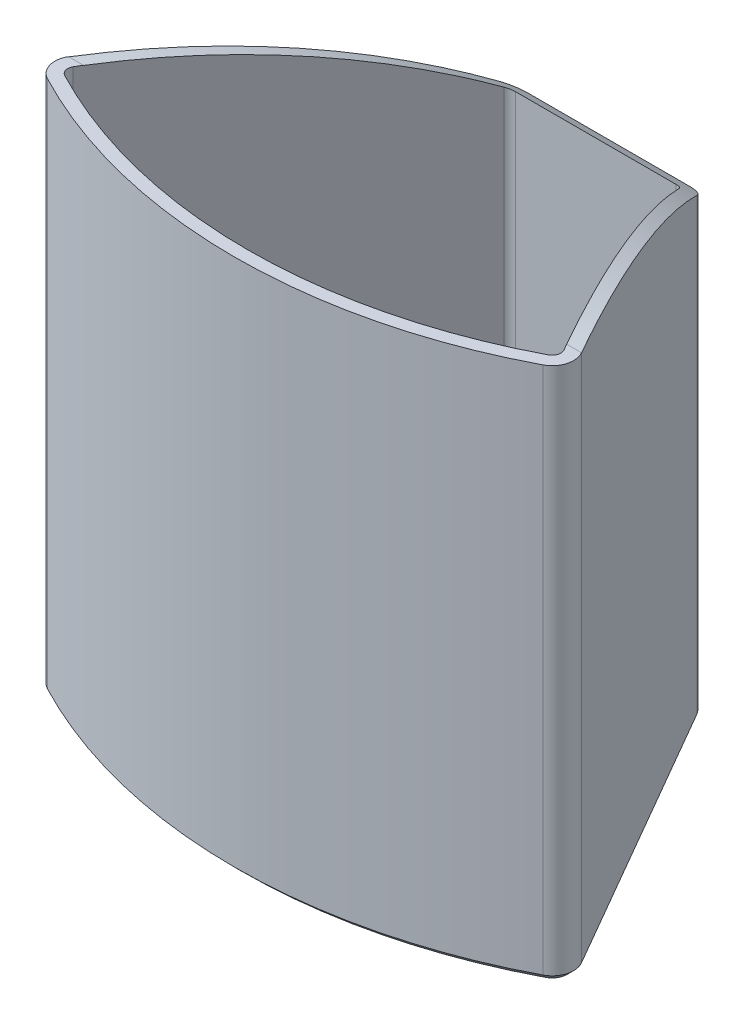
from build123d import *

# Parameters (mm, degrees)
SKETCH_1_R               = 50
EXTRUDE_1_DEPTH          = 50
CUT_EXTRUDE_2_DEPTH      = 87.602540378
CUT_EXTRUDE_3_DEPTH      = 76
FILLET_1_R               = 2
CHAMFER_1_SIZE           = 0.6
SHELL_1_T                = -1.2
EXTRUDE_2_DEPTH          = 2
EXTRUDE_2_DEPTH_BACK     = 2
SKETCH_4_R               = 1.5
SKETCH_5_R               = 1.5
EXTRUDE_3_DEPTH          = 3
CUT_EXTRUDE_4_DEPTH      = 75.752405905
CUT_EXTRUDE_4_DEPTH_BACK = 75.752405905
SKETCH_7_W               = 6.6
SKETCH_7_H               = 5.6
SKETCH_7_W_2             = 4
SKETCH_7_H_2             = 3
EXTRUDE_4_DEPTH          = 2.2
SKETCH_8_W               = 4
SKETCH_8_H               = 3
CUT_EXTRUDE_7_DEPTH      = 1.2
SKETCH_9_W               = 48.891646461
SKETCH_9_H               = 14.735047163
CUT_EXTRUDE_8_DEPTH      = 75.752405905
CHAMFER_2_SIZE           = 0.4
SKETCH_10_W              = 4.2
SKETCH_10_H              = 3.2
SKETCH_10_W_2            = 4
SKETCH_10_H_2            = 3
CUT_EXTRUDE_9_DEPTH      = 73.52228753
SKETCH_11_W              = 6.6
SKETCH_11_H              = 5.6
EXTRUDE_5_DEPTH          = 1.2


with BuildPart() as part:
    # 草图1 → 凸台-拉伸1 (new body)
    with BuildSketch(Plane(origin=(0, 0, 0), x_dir=(1, 0, 0), z_dir=(0, 1, 0))):
        with Locations(Location((0, 0, 0), (0, 0, 270))):
            Circle(SKETCH_1_R)
    extrude(amount=EXTRUDE_1_DEPTH)

    # 草图2 → 切除-拉伸2 (cut, through all)
    with BuildSketch(Plane(origin=(0, 50, 0), x_dir=(1, 0, 0), z_dir=(0, 1, 0))):
        with BuildLine():
            Line((-25, -43.301270189), (0, 0))
            Line((0, 0), (25, -43.301270189))
            ThreePointArc((25, -43.301270189), (0, 50), (-25, -43.301270189))
        make_face()
    extrude(amount=-CUT_EXTRUDE_2_DEPTH, mode=Mode.SUBTRACT)

    # 草图3 → 切除-拉伸3 (cut, through all)
    with BuildSketch(Plane(origin=(0, 50, 0), x_dir=(1, 0, 0), z_dir=(0, 1, 0))):
        with BuildLine():
            ThreePointArc((-7.5, -12.990381057), (-3.882285677, -14.488887394), (0, -15))
            ThreePointArc((0, -15), (3.882285677, -14.488887394), (7.5, -12.990381057))
            Line((7.5, -12.990381057), (0, 0))
            Line((0, 0), (-7.5, -12.990381057))
        make_face()
        with BuildLine():
            ThreePointArc((15, 0), (-7.5, 12.990381057), (-7.5, -12.990381057))
            Line((-7.5, -12.990381057), (0, 0))
            Line((0, 0), (7.5, -12.990381057))
            ThreePointArc((7.5, -12.990381057), (12.990381057, -7.5), (15, 0))
        make_face()
        with BuildLine():
            ThreePointArc((7.5, -12.990381057), (3.882285677, -14.488887394), (0, -15))
            Line((0, -15), (8.660254038, -15))
            Line((8.660254038, -15), (7.5, -12.990381057))
        make_face()
        with BuildLine():
            Line((-7.5, -12.990381057), (-8.660254038, -15))
            Line((-8.660254038, -15), (0, -15))
            ThreePointArc((0, -15), (-3.882285677, -14.488887394), (-7.5, -12.990381057))
        make_face()
    extrude(amount=-CUT_EXTRUDE_3_DEPTH, mode=Mode.SUBTRACT)

    # 圆角1
    fillet_1_edges = [part.edges().sort_by_distance(p)[0] for p in [
        (25, 25, 43.301270189),
        (-25, 25, 43.301270189),
        (-8.660254038, 25, 15),
        (8.660254038, 25, 15),
    ]]
    fillet(fillet_1_edges, radius=FILLET_1_R)

    # 倒角1
    chamfer_1_edges = [part.edges().sort_by_distance(p)[0] for p in [
        (0, 0, 15),
        (-16.608380962, 0, 28.766559657),
        (16.608380962, 0, 28.766559657),
        (0, 0, 50),
        (8.505553499, 0, 15.267949192),
        (24.167752526, 0, 43.090900659),
        (-24.167752526, 0, 43.090900659),
        (-8.505553499, 0, 15.267949192),
    ]]
    chamfer(chamfer_1_edges, length=CHAMFER_1_SIZE)

    # 抽壳1
    shell_1_openings = [part.faces().sort_by_distance(p)[0] for p in [
        (0, 50, 34.229276229),
    ]]
    offset(amount=SHELL_1_T, openings=shell_1_openings)

    # 草图4 → 凸台-拉伸2 (add, two sides: drawn at the far end of the back side and taken through both)
    with BuildSketch(Plane(origin=(0, 0, 0), x_dir=(0, 0, -1), z_dir=(1, 0, 0)).offset(-EXTRUDE_2_DEPTH_BACK)):
        with BuildLine():
            Line((-44.5, 0), (-44.5, -3))
            ThreePointArc((-44.5, -3), (-43, -1.5), (-41.5, -3))
            Line((-41.5, -3), (-41.5, 0))
            Line((-41.5, 0), (-44.5, 0))
        make_face()
        with Locations((-43, -3)):
            Circle(SKETCH_4_R)
    extrude(amount=EXTRUDE_2_DEPTH + EXTRUDE_2_DEPTH_BACK)

    # 草图5 → 凸台-拉伸3 (add)
    with BuildSketch(Plane(origin=(2, 0, 0), x_dir=(0, 0, -1), z_dir=(1, 0, 0))):
        with Locations((-43, -3)):
            Circle(SKETCH_5_R)
    extrude_3 = extrude(amount=EXTRUDE_3_DEPTH)

    # 镜向1: 凸台-拉伸3 across plane
    add(extrude_3.mirror(Plane(origin=(0, 0, 0), x_dir=(0, 0, 1), z_dir=(1, 0, 0))))

    # 草图6 → 切除-拉伸4 (cut, two sides: drawn at the far end of the back side and taken through both)
    with BuildSketch(Plane(origin=(0, 0, 0), x_dir=(0, 0, -1), z_dir=(1, 0, 0)).offset(-CUT_EXTRUDE_4_DEPTH_BACK)):
        with BuildLine():
            ThreePointArc((-41.533119315, 49.979696687), (-27.735886723, 47.754377603), (-15, 42))
            Line((-15, 42), (-15, 50))
            Line((-15, 50), (-16, 50))
            Line((-16, 50), (-41.533119315, 50))
            Line((-41.533119315, 50), (-41.533119315, 49.979696687))
        make_face()
    extrude(amount=CUT_EXTRUDE_4_DEPTH + CUT_EXTRUDE_4_DEPTH_BACK, mode=Mode.SUBTRACT)

    # 草图7 → 凸台-拉伸4 (add)
    with BuildSketch(Plane(origin=(0, 1.2, 0), x_dir=(1, 0, 0), z_dir=(0, 1, 0))):
        with Locations((0, -43)):
            Rectangle(SKETCH_7_W, SKETCH_7_H)
        with Locations((0, -43)):
            Rectangle(SKETCH_7_W_2, SKETCH_7_H_2, mode=Mode.SUBTRACT)
    extrude(amount=EXTRUDE_4_DEPTH)

    # 草图8 → 切除-拉伸7 (cut)
    with BuildSketch(Plane(origin=(0, 1.2, 0), x_dir=(1, 0, 0), z_dir=(0, 1, 0))):
        with Locations((0, -43)):
            Rectangle(SKETCH_8_W, SKETCH_8_H)
    extrude(amount=-CUT_EXTRUDE_7_DEPTH, mode=Mode.SUBTRACT)


with BuildPart() as cut_extrude_7_piece_1:
    # of the separate pieces the step leaves, piece 1, a body of its own (cut_extrude_7_pieces)
    add(part.part.solids().sort_by_distance((-23.174069593, 0.6, 44.305332619))[0])

    # 倒角2
    chamfer_2_edges = [cut_extrude_7_piece_1.edges().sort_by_distance(p)[0] for p in [
        (-2, 0, 43),
        (0, 0, 41.5),
        (0, 0, 44.5),
        (2, 0, 43),
    ]]
    chamfer(chamfer_2_edges, length=CHAMFER_2_SIZE)

    # 草图10 → 切除-拉伸9 (cut, through all)
    with BuildSketch(Plane(origin=(0, 3.4, 0), x_dir=(1, 0, 0), z_dir=(0, 1, 0))):
        with Locations((0, -43)):
            Rectangle(SKETCH_10_W, SKETCH_10_H)
        with Locations((0, -43)):
            Rectangle(SKETCH_10_W_2, SKETCH_10_H_2, mode=Mode.SUBTRACT)
    extrude(amount=-CUT_EXTRUDE_9_DEPTH, mode=Mode.SUBTRACT)

    # 草图11 → 凸台-拉伸5 (add)
    with BuildSketch(Plane(origin=(0, 3.4, 0), x_dir=(1, 0, 0), z_dir=(0, 1, 0))):
        with Locations((0, -43)):
            Rectangle(SKETCH_11_W, SKETCH_11_H)
    extrude(amount=EXTRUDE_5_DEPTH)


with BuildPart() as cut_extrude_7_piece_2:
    # of the separate pieces the step leaves, piece 2, a body of its own (cut_extrude_7_pieces)
    add(part.part.solids().sort_by_distance((-2, -3, 41.5))[0])

    # 草图9 → 切除-拉伸8 (cut, through all)
    with BuildSketch(Plane.XZ):
        with Locations((-1.815492917, 42.673305219)):
            Rectangle(SKETCH_9_W, SKETCH_9_H)
    extrude(amount=CUT_EXTRUDE_8_DEPTH, mode=Mode.SUBTRACT)


solid = cut_extrude_7_piece_1.part
